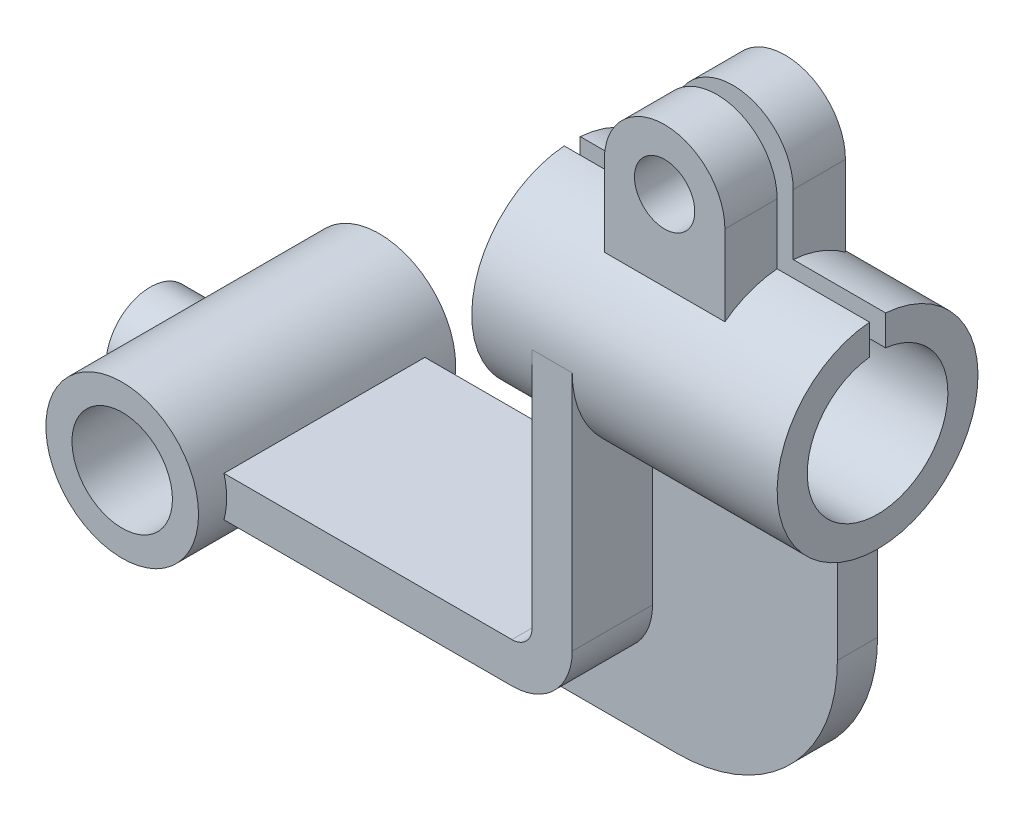
from build123d import *

# Parameters (mm, degrees)
SKETCH_2_R                      = 25
SKETCH_2_R_2                    = 17.5
EXTRUDE_1_DEPTH                 = 38
SKETCH_3_R                      = 7.5
EXTRUDE_2_DEPTH                 = 15
CUT_EXTRUDE_START               = 70
SKETCH_4_W                      = 76
SKETCH_4_H                      = 4
CUT_EXTRUDE_1_DEPTH             = 64.018795664
EXTRUDE_3_DEPTH                 = 25
EXTRUDE_4_DEPTH                 = 5
SKETCH_5_6_R                    = 19
SKETCH_5_6_R_2                  = 12.5
EXTRUDE_5_DEPTH                 = 32
EXTRUDE_6_REACH                 = 224.284
EXTRUDE_6_END_RADIUS            = 19
SKETCH_7_R                      = 11
SKETCH_7_R_2                    = 7.5
CUT_EXTRUDE_2_REACH             = 224.284
SKETCH_7_2_R                    = 7.5
CUT_EXTRUDE_3_REACH             = 194.608
SKETCH_8_R                      = 17.5
CUT_EXTRUDE_3_DIRECTION_2_DEPTH = 193.608411122


with BuildPart() as part:
    # 草图2 → 凸台-拉伸1 (new, symmetric)
    with BuildSketch(Plane(origin=(0, 0, 0), x_dir=(0, 0, -1), z_dir=(1, 0, 0))):
        with Locations((0, 70)):
            Circle(SKETCH_2_R)
        with Locations((0, 70)):
            Circle(SKETCH_2_R_2, mode=Mode.SUBTRACT)
    extrude(amount=EXTRUDE_1_DEPTH, both=True)

    # 草图3 → 凸台-拉伸2 (add, symmetric)
    with BuildSketch(Plane.XY):
        with BuildLine():
            Line((-15, 110), (-15, 87.5))
            Line((-15, 87.5), (15, 87.5))
            Line((15, 87.5), (15, 110))
            ThreePointArc((15, 110), (0, 125), (-15, 110))
        make_face()
        with Locations((0, 110)):
            Circle(SKETCH_3_R, mode=Mode.SUBTRACT)
    extrude(amount=EXTRUDE_2_DEPTH, both=True)

    # 草图4 → 切除-拉伸1 (cut, through all)
    with BuildSketch(Plane(origin=(0, 0, 0), x_dir=(1, 0, 0), z_dir=(0, 1, 0)).offset(CUT_EXTRUDE_START)):
        Rectangle(SKETCH_4_W, SKETCH_4_H)
    extrude(amount=CUT_EXTRUDE_1_DEPTH, mode=Mode.SUBTRACT)

    # 草图5 → 凸台-拉伸3 (add, symmetric)
    with BuildSketch(Plane.XY):
        with BuildLine():
            Line((-28, 5), (-99.66969722, 5))
            ThreePointArc((-99.66969722, 5), (-99.168168533, 2.522325037), (-99, 0))
            ThreePointArc((-99, 0), (-99.168168533, -2.522325037), (-99.66969722, -5))
            Line((-99.66969722, -5), (-28, -5))
            ThreePointArc((-28, -5), (-17.393398282, -0.606601718), (-13, 10))
            Line((-13, 10), (-13, 70))
            Line((-13, 70), (-23, 70))
            Line((-23, 70), (-23, 10))
            ThreePointArc((-23, 10), (-24.464466094, 6.464466094), (-28, 5))
        make_face()
    extrude(amount=EXTRUDE_3_DEPTH, both=True)

    # 草图5<5> → 凸台-拉伸4 (add, symmetric)
    with BuildSketch(Plane.XY):
        with BuildLine():
            ThreePointArc((-99.66969722, -5), (-106.467437405, -15.099668871), (-118, -19))
            Line((-118, -19), (-7, -19))
            ThreePointArc((-7, -19), (21.284271247, -7.284271247), (33, 21))
            Line((33, 21), (33, 70))
            Line((33, 70), (-13, 70))
            Line((-13, 70), (-13, 10))
            ThreePointArc((-13, 10), (-17.393398282, -0.606601718), (-28, -5))
            Line((-28, -5), (-99.66969722, -5))
        make_face()
    extrude(amount=EXTRUDE_4_DEPTH, both=True)

    # 草图5<6> → 凸台-拉伸5 (add, symmetric)
    with BuildSketch(Plane.XY):
        with Locations((-118, 0)):
            Circle(SKETCH_5_6_R)
        with Locations((-118, 0)):
            Circle(SKETCH_5_6_R_2, mode=Mode.SUBTRACT)
    extrude(amount=EXTRUDE_5_DEPTH, both=True)

    # 凸台-拉伸6: up to this cylinder (the profile starts outside it)
    extrude_6_end = Plane(origin=(-118, 0, -10.688873), z_dir=(0, 0, -1)) * Cylinder(EXTRUDE_6_END_RADIUS, 487.568, mode=Mode.PRIVATE)
    # 草图7 → 凸台-拉伸6 (add, up to the surface)
    with BuildSketch(Plane.ZY.offset(143), mode=Mode.PRIVATE) as extrude_6_sk1:
        Circle(SKETCH_7_R)
        Circle(SKETCH_7_R_2, mode=Mode.SUBTRACT)
    extrude_6_tool1 = extrude(extrude_6_sk1.sketch, amount=-EXTRUDE_6_REACH, mode=Mode.PRIVATE) - extrude_6_end
    add(extrude_6_tool1.solids().sort_by_distance((-143, 0, -10.688873))[0])

    # 草图7<2> → 切除-拉伸2 (cut, up to next)
    with BuildSketch(Plane.ZY.offset(143), mode=Mode.PRIVATE) as cut_extrude_2_sk1:
        Circle(SKETCH_7_2_R)
    cut_extrude_2_tool1 = extrude(cut_extrude_2_sk1.sketch, amount=-CUT_EXTRUDE_2_REACH, mode=Mode.PRIVATE) & part.part
    add(cut_extrude_2_tool1.solids().sort_by_distance((-143, 0, 0))[0], mode=Mode.SUBTRACT)

    # 草图8 → 切除-拉伸3 (cut, up to next)
    with BuildSketch(Plane(origin=(0, 0, 0), x_dir=(0, 0, -1), z_dir=(1, 0, 0)), mode=Mode.PRIVATE) as cut_extrude_3_sk1:
        with Locations((0, 70)):
            Circle(SKETCH_8_R)
    cut_extrude_3_tool1 = extrude(cut_extrude_3_sk1.sketch, amount=-CUT_EXTRUDE_3_REACH, mode=Mode.PRIVATE) & part.part
    add(cut_extrude_3_tool1.solids().sort_by_distance((0, 70, 0))[0], mode=Mode.SUBTRACT)

    # 草图8 → 切除-拉伸3 direction 2 (cut)
    with BuildSketch(Plane(origin=(0, 0, 0), x_dir=(0, 0, -1), z_dir=(1, 0, 0))):
        with Locations((0, 70)):
            Circle(SKETCH_8_R)
    extrude(amount=CUT_EXTRUDE_3_DIRECTION_2_DEPTH, mode=Mode.SUBTRACT)


solid = part.part
